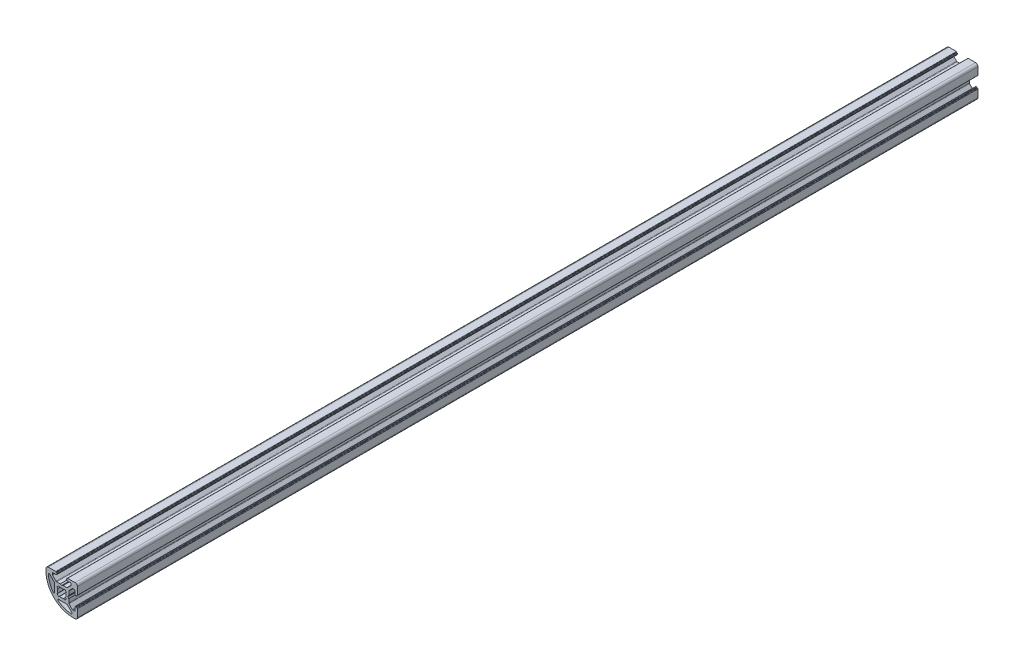
from build123d import *

# Parameters (mm, degrees)
EXTRUDE1_DEPTH = 574


with BuildPart() as part:
    # Sketch1 → Extrude1 (new body)
    with BuildSketch(Plane.XY):
        with BuildLine():
            Line((3.232233116, 4.565447254), (0.953589838, 4.565447254))
            ThreePointArc((0.953589838, 4.565447254), (0.901826028, 4.558632419), (0.853589836, 4.538652333))
            Line((0.853589836, 4.538652333), (0.100000003, 4.103567024))
            ThreePointArc((0.100000003, 4.103567024), (0, 4.076772104), (-0.100000003, 4.103567024))
            Line((-0.100000003, 4.103567024), (-0.853589836, 4.538652333))
            ThreePointArc((-0.853589836, 4.538652333), (-0.901826028, 4.558632419), (-0.953589838, 4.565447254))
            Line((-0.953589838, 4.565447254), (-3.232233116, 4.565447254))
            ThreePointArc((-3.232233116, 4.565447254), (-3.417445277, 4.601015929), (-3.576306433, 4.702661433))
            Line((-3.576306433, 4.702661433), (-5.844073317, 6.853456827))
            ThreePointArc((-5.844073317, 6.853456827), (-5.959367314, 7.018804885), (-6, 7.216242649))
            Line((-6, 7.216242649), (-6, 7.948478858))
            ThreePointArc((-6, 7.948478858), (-5.855954134, 8.296236342), (-5.50819665, 8.440282208))
            Line((-5.50819665, 8.440282208), (-3.49180335, 8.440282208))
            ThreePointArc((-3.49180335, 8.440282208), (-3.144045866, 8.584328074), (-3, 8.932085558))
            Line((-3, 8.932085558), (-3, 9.249999634))
            ThreePointArc((-3, 9.249999634), (-3.058578644, 9.39142099), (-3.2, 9.449999634))
            Line((-3.2, 9.449999634), (-3.350000366, 9.449999634))
            ThreePointArc((-3.350000366, 9.449999634), (-3.491421722, 9.508578278), (-3.550000366, 9.649999634))
            Line((-3.550000366, 9.649999634), (-3.550000366, 9.8))
            ThreePointArc((-3.550000366, 9.8), (-3.60857901, 9.941421356), (-3.750000366, 10))
            Line((-3.750000366, 10), (-8.50000115, 10))
            ThreePointArc((-8.50000115, 10), (-9.560660508, 9.560660508), (-10, 8.50000115))
            Line((-10, 8.50000115), (-10, 7))
            ThreePointArc((-10, 7), (-5.02081528, -5.02081528), (7, -10))
            Line((7, -10), (8.50000115, -10))
            ThreePointArc((8.50000115, -10), (9.560660508, -9.560660508), (10, -8.50000115))
            Line((10, -8.50000115), (10, -3.750000366))
            ThreePointArc((10, -3.750000366), (9.941421356, -3.60857901), (9.8, -3.550000366))
            Line((9.8, -3.550000366), (9.649999634, -3.550000366))
            ThreePointArc((9.649999634, -3.550000366), (9.508578278, -3.491421722), (9.449999634, -3.350000366))
            Line((9.449999634, -3.350000366), (9.449999634, -3.2))
            ThreePointArc((9.449999634, -3.2), (9.39142099, -3.058578644), (9.249999634, -3))
            Line((9.249999634, -3), (8.866638303, -3))
            ThreePointArc((8.866638303, -3), (8.518880819, -3.144045866), (8.374834953, -3.49180335))
            Line((8.374834953, -3.49180335), (8.374834953, -5.50819665))
            ThreePointArc((8.374834953, -5.50819665), (8.230789087, -5.855954134), (7.883031603, -6))
            Line((7.883031603, -6), (7.150795394, -6))
            ThreePointArc((7.150795394, -6), (6.95335763, -5.959367314), (6.788009572, -5.844073317))
            Line((6.788009572, -5.844073317), (4.637214178, -3.576306432))
            ThreePointArc((4.637214178, -3.576306432), (4.535568675, -3.417445276), (4.5, -3.232233115))
            Line((4.5, -3.232233115), (4.5, -0.953589838))
            ThreePointArc((4.5, -0.953589838), (4.493185165, -0.901826026), (4.473205078, -0.853589834))
            Line((4.473205078, -0.853589834), (4.038119764, -0.100000004))
            ThreePointArc((4.038119764, -0.100000004), (4.011324842, 0), (4.038119764, 0.100000004))
            Line((4.038119764, 0.100000004), (4.473205078, 0.853589834))
            ThreePointArc((4.473205078, 0.853589834), (4.493185165, 0.901826026), (4.5, 0.953589838))
            Line((4.5, 0.953589838), (4.5, 3.232233115))
            ThreePointArc((4.5, 3.232233115), (4.535568675, 3.417445276), (4.637214178, 3.576306432))
            Line((4.637214178, 3.576306432), (6.788009572, 5.844073317))
            ThreePointArc((6.788009572, 5.844073317), (6.95335763, 5.959367314), (7.150795394, 6))
            Line((7.150795394, 6), (7.883031603, 6))
            ThreePointArc((7.883031603, 6), (8.230789087, 5.855954134), (8.374834953, 5.50819665))
            Line((8.374834953, 5.50819665), (8.374834953, 3.49180335))
            ThreePointArc((8.374834953, 3.49180335), (8.518880819, 3.144045866), (8.866638303, 3))
            Line((8.866638303, 3), (9.249999634, 3))
            ThreePointArc((9.249999634, 3), (9.39142099, 3.058578644), (9.449999634, 3.2))
            Line((9.449999634, 3.2), (9.449999634, 3.350000366))
            ThreePointArc((9.449999634, 3.350000366), (9.508578278, 3.491421722), (9.649999634, 3.550000366))
            Line((9.649999634, 3.550000366), (9.8, 3.550000366))
            ThreePointArc((9.8, 3.550000366), (9.941421356, 3.60857901), (10, 3.750000366))
            Line((10, 3.750000366), (10, 8.50000115))
            ThreePointArc((10, 8.50000115), (9.560660508, 9.560660508), (8.50000115, 10))
            Line((8.50000115, 10), (3.750000366, 10))
            ThreePointArc((3.750000366, 10), (3.60857901, 9.941421356), (3.550000366, 9.8))
            Line((3.550000366, 9.8), (3.550000366, 9.649999634))
            ThreePointArc((3.550000366, 9.649999634), (3.491421722, 9.508578278), (3.350000366, 9.449999634))
            Line((3.350000366, 9.449999634), (3.2, 9.449999634))
            ThreePointArc((3.2, 9.449999634), (3.058578644, 9.39142099), (3, 9.249999634))
            Line((3, 9.249999634), (3, 8.932085558))
            ThreePointArc((3, 8.932085558), (3.144045866, 8.584328074), (3.49180335, 8.440282208))
            Line((3.49180335, 8.440282208), (5.50819665, 8.440282208))
            ThreePointArc((5.50819665, 8.440282208), (5.855954134, 8.296236342), (6, 7.948478858))
            Line((6, 7.948478858), (6, 7.216242649))
            ThreePointArc((6, 7.216242649), (5.959367314, 7.018804885), (5.844073317, 6.853456827))
            Line((5.844073317, 6.853456827), (3.576306433, 4.702661433))
            ThreePointArc((3.576306433, 4.702661433), (3.417445277, 4.601015929), (3.232233116, 4.565447254))
        make_face()
        with BuildLine():
            Line((1.258185436, 2.445295362), (1.887055008, 2.947714945))
            ThreePointArc((1.887055008, 2.947714945), (2.474873794, 2.474873674), (2.947715037, 1.887054865))
            Line((2.947715037, 1.887054865), (2.445295423, 1.258185317))
            ThreePointArc((2.445295423, 1.258185317), (2.75, -6.7e-08), (2.445295362, -1.258185436))
            Line((2.445295362, -1.258185436), (2.947714945, -1.887055008))
            ThreePointArc((2.947714945, -1.887055008), (2.474873674, -2.474873794), (1.887054865, -2.947715037))
            Line((1.887054865, -2.947715037), (1.258185317, -2.445295423))
            ThreePointArc((1.258185317, -2.445295423), (-6.7e-08, -2.75), (-1.258185436, -2.445295362))
            Line((-1.258185436, -2.445295362), (-1.887055008, -2.947714945))
            ThreePointArc((-1.887055008, -2.947714945), (-2.474873794, -2.474873674), (-2.947715037, -1.887054865))
            Line((-2.947715037, -1.887054865), (-2.445295423, -1.258185317))
            ThreePointArc((-2.445295423, -1.258185317), (-2.75, 6.7e-08), (-2.445295362, 1.258185436))
            Line((-2.445295362, 1.258185436), (-2.947714945, 1.887055008))
            ThreePointArc((-2.947714945, 1.887055008), (-2.474873674, 2.474873794), (-1.887054865, 2.947715037))
            Line((-1.887054865, 2.947715037), (-1.258185317, 2.445295423))
            ThreePointArc((-1.258185317, 2.445295423), (6.7e-08, 2.75), (1.258185436, 2.445295362))
        make_face(mode=Mode.SUBTRACT)
        with BuildLine():
            Line((3.232233163, -4.499999714), (-2.000000051, -4.499999587))
            ThreePointArc((-2.000000051, -4.499999587), (-2.474341709, -4.841885693), (-2.300000072, -5.399999581))
            ThreePointArc((-2.300000072, -5.399999581), (1.713541858, -7.57063318), (6.185210557, -8.478569349))
            ThreePointArc((6.185210557, -8.478569349), (6.668243282, -8.182681825), (6.565047479, -7.625707261))
            Line((6.565047479, -7.625707261), (3.585786542, -4.646446324))
            ThreePointArc((3.585786542, -4.646446324), (3.423574873, -4.53805995), (3.232233163, -4.499999714))
        make_face(mode=Mode.SUBTRACT)
        with BuildLine():
            Line((-4.646446492, 3.585787135), (-7.625707283, 6.565048217))
            ThreePointArc((-7.625707283, 6.565048217), (-8.182681843, 6.668244047), (-8.47856939, 6.185211338))
            ThreePointArc((-8.47856939, 6.185211338), (-7.570633447, 1.713542596), (-5.400000054, -2.299999441))
            ThreePointArc((-5.400000054, -2.299999441), (-4.841886176, -2.474341107), (-4.500000045, -1.999999467))
            Line((-4.500000045, -1.999999467), (-4.499999899, 3.232233748))
            ThreePointArc((-4.499999899, 3.232233748), (-4.538060126, 3.42357546), (-4.646446492, 3.585787135))
        make_face(mode=Mode.SUBTRACT)
    extrude(amount=EXTRUDE1_DEPTH)


solid = part.part
